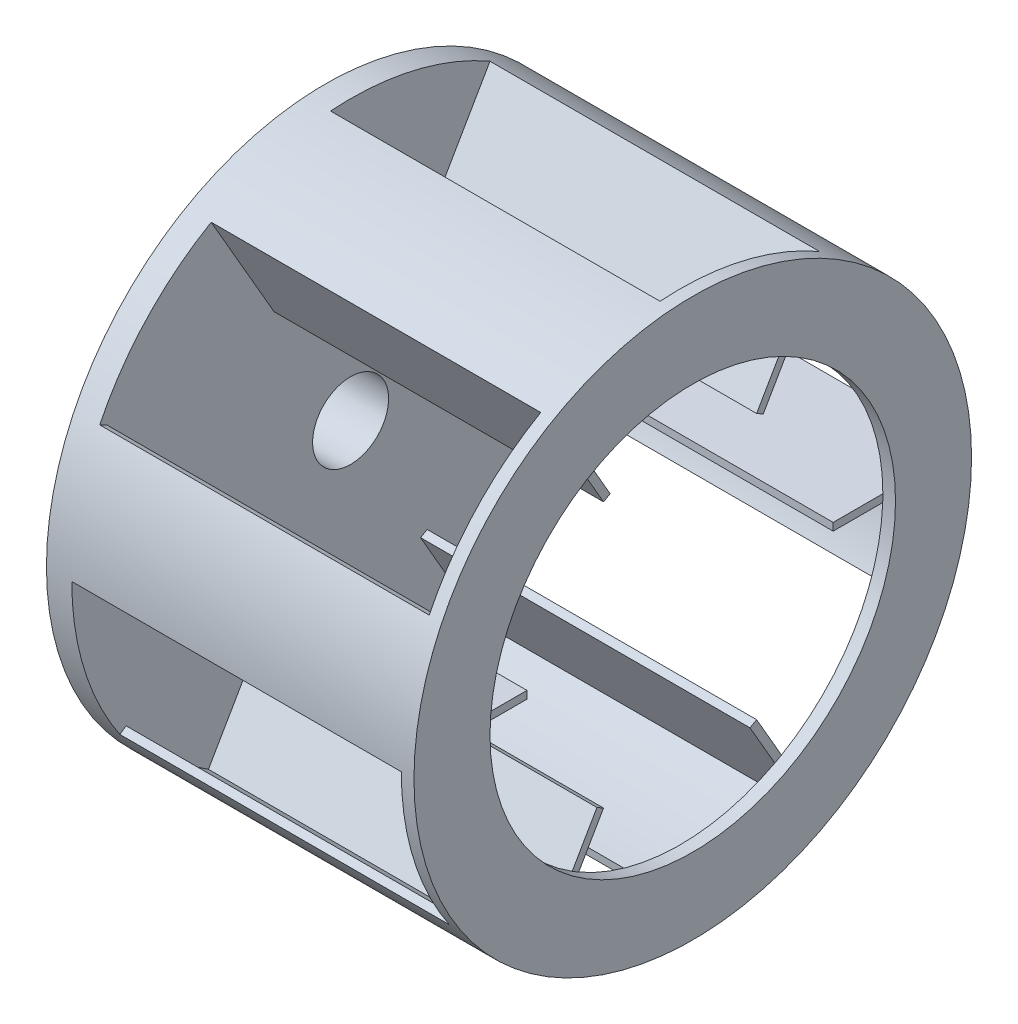
from build123d import *
from build123d.topology import SkipClean

# Parameters (mm, degrees)
SKETCH1_R           = 5.5
BOSS_EXTRUDE1_DEPTH = 0.25
SKETCH2_R           = 1.5
BOSS_EXTRUDE2_DEPTH = 2.5
SKETCH3_R           = 0.75
CUT_EXTRUDE1_DEPTH  = 9.336666
BOSS_EXTRUDE3_START = 6.5
BOSS_EXTRUDE3_DEPTH = 6.5
CIRPATTERN1_COUNT   = 6
BOSS_EXTRUDE6_START = 0.25
SKETCH5_R           = 5.5
SKETCH5_R_2         = 4
BOSS_EXTRUDE6_DEPTH = 0.25


with BuildPart() as part:
    # Sketch1 → Boss-Extrude1 (new, symmetric)
    with BuildSketch(Plane(origin=(0, 0, 0), x_dir=(0, 0, -1), z_dir=(1, 0, 0))):
        Circle(SKETCH1_R)
    extrude(amount=BOSS_EXTRUDE1_DEPTH, both=True)

    # Sketch2 → Boss-Extrude2 (add)
    with BuildSketch(Plane.ZY.offset(0.25)):
        Circle(SKETCH2_R)
    extrude(amount=BOSS_EXTRUDE2_DEPTH)

    # Sketch3 → Cut-Extrude1 (cut, through all)
    with BuildSketch(Plane.ZY.offset(2.75)):
        Circle(SKETCH3_R)
    extrude(amount=-CUT_EXTRUDE1_DEPTH, mode=Mode.SUBTRACT)

    # Sketch4 → Boss-Extrude3 (add)
    with BuildSketch(Plane(origin=(0.25, 0, 0), x_dir=(0, 0, -1), z_dir=(1, 0, 0)).offset(BOSS_EXTRUDE3_START)):
        with BuildLine():
            Line((-5.5, 0), (-3.02, 0))
            Line((-3.02, 0), (-3.02, 0.15))
            Line((-3.02, 0.15), (-5.347896783, 0.15))
            ThreePointArc((-5.347896783, 0.15), (-5.196916014, 1.270654927), (-4.813771652, 2.334545455))
            Line((-4.813771652, 2.334545455), (-4.948737213, 2.4))
            ThreePointArc((-4.948737213, 2.4), (-5.360412982, 1.231248417), (-5.5, 0))
        make_face()
    boss_extrude3 = extrude(amount=-BOSS_EXTRUDE3_DEPTH)

    # CirPattern1: Boss-Extrude3 ×6 about axis
    with SkipClean():  # the faces are left unmerged after this step: merging them gives an invalid solid
        cirpattern1_axis = Axis((0, 0, 0), (1, 0, 0))
        for i in range(1, CIRPATTERN1_COUNT):
            add(boss_extrude3.rotate(cirpattern1_axis, i * 360 / CIRPATTERN1_COUNT))

    # Sketch5 → Boss-Extrude6 (add)
    with SkipClean():  # the faces are left unmerged after this step: merging them gives an invalid solid
        with BuildSketch(Plane(origin=(6.75, 0, 0), x_dir=(0, 0, -1), z_dir=(1, 0, 0)).offset(BOSS_EXTRUDE6_START)):
            Circle(SKETCH5_R)
            Circle(SKETCH5_R_2, mode=Mode.SUBTRACT)
        extrude(amount=-BOSS_EXTRUDE6_DEPTH)


solid = part.part
